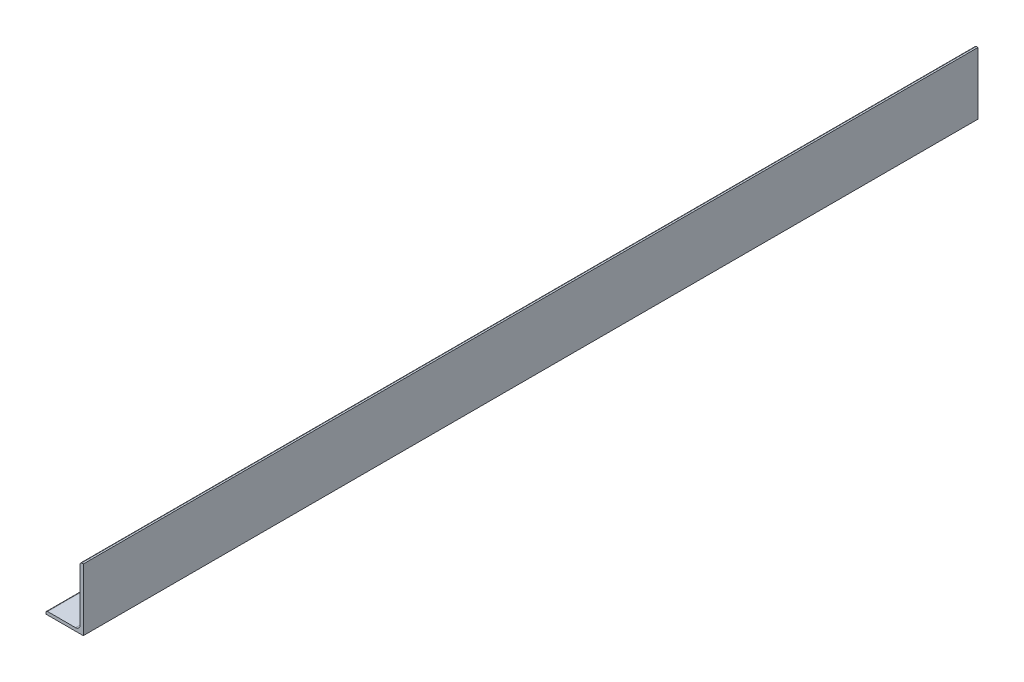
from build123d import *

# Parameters (mm, degrees)
BOSS_EXTRUDE1_DEPTH = 457.2


with BuildPart() as part:
    # Sketch2 → Boss-Extrude1 (new, symmetric)
    with BuildSketch(Plane.XY):
        with BuildLine():
            Line((-19.05, -31.75), (19.05, -31.75))
            Line((19.05, -31.75), (19.05, 31.75))
            Line((19.05, 31.75), (17.4625, 31.75))
            ThreePointArc((17.4625, 31.75), (16.339967985, 31.285032015), (15.875, 30.1625))
            Line((15.875, 30.1625), (15.875, -23.7998))
            ThreePointArc((15.875, -23.7998), (14.476376302, -27.176376302), (11.0998, -28.575))
            Line((11.0998, -28.575), (-17.4625, -28.575))
            ThreePointArc((-17.4625, -28.575), (-18.585032015, -29.039967985), (-19.05, -30.1625))
            Line((-19.05, -30.1625), (-19.05, -31.75))
        make_face()
    extrude(amount=BOSS_EXTRUDE1_DEPTH, both=True)


solid = part.part
